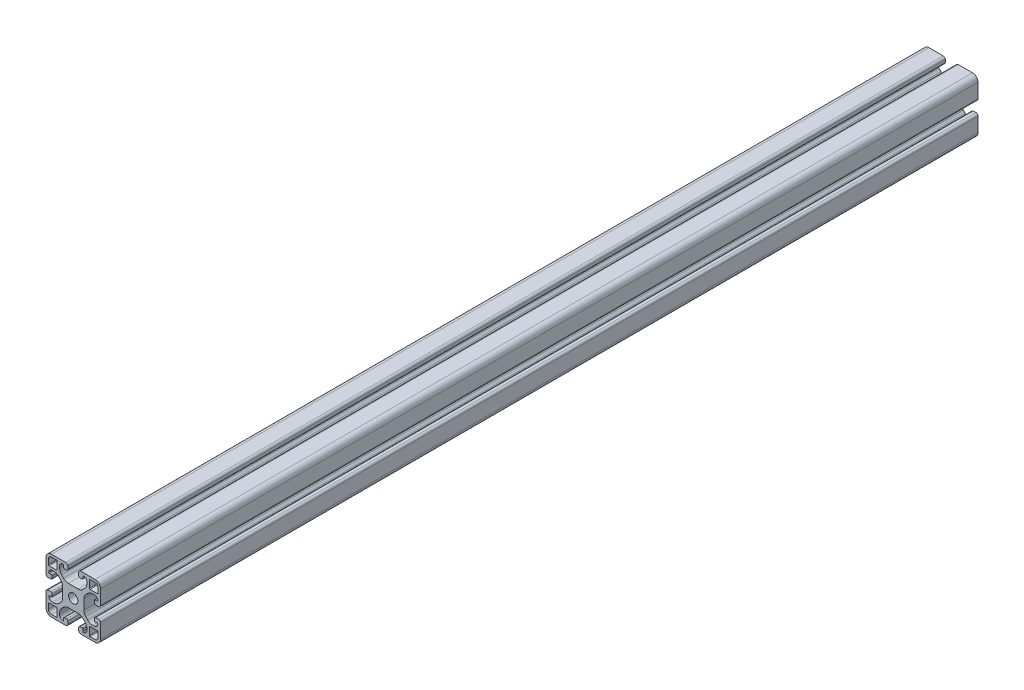
from build123d import *

# Parameters (mm, degrees)
ESQUISSE1_R        = 3.4
BOSS_EXTRU_1_DEPTH = 644


with BuildPart() as part:
    # Esquisse1 → Boss.-Extru.1 (new body)
    with BuildSketch(Plane(origin=(0, 0, -30), x_dir=(-1, 0, 0), z_dir=(0, 0, -1))):
        with BuildLine():
            Line((-4.5, 15), (-4.5, 13.5))
            ThreePointArc((-4.5, 13.5), (-4.353553391, 13.146446609), (-4, 13))
            Line((-4, 13), (-2.5, 13))
            ThreePointArc((-2.5, 13), (-2.146446609, 12.853553391), (-2, 12.5))
            ThreePointArc((-2, 12.5), (-2.732233047, 10.732233047), (-4.5, 10))
            Line((-4.5, 10), (-5.807611845, 10))
            ThreePointArc((-5.807611845, 10), (-7.721029006, 10.380602337), (-9.343145751, 11.464466094))
            Line((-9.343145751, 11.464466094), (-10.785533906, 12.906854249))
            ThreePointArc((-10.785533906, 12.906854249), (-11.869397663, 14.528970994), (-12.25, 16.442388155))
            Line((-12.25, 16.442388155), (-12.25, 23.557611845))
            ThreePointArc((-12.25, 23.557611845), (-11.869397663, 25.471029006), (-10.785533906, 27.093145751))
            Line((-10.785533906, 27.093145751), (-9.343145751, 28.535533906))
            ThreePointArc((-9.343145751, 28.535533906), (-7.721029006, 29.619397663), (-5.807611845, 30))
            Line((-5.807611845, 30), (-4.5, 30))
            ThreePointArc((-4.5, 30), (-2.732233047, 29.267766953), (-2, 27.5))
            ThreePointArc((-2, 27.5), (-2.146446609, 27.146446609), (-2.5, 27))
            Line((-2.5, 27), (-4, 27))
            ThreePointArc((-4, 27), (-4.353553391, 26.853553391), (-4.5, 26.5))
            Line((-4.5, 26.5), (-4.5, 25))
            ThreePointArc((-4.5, 25), (-4.207106781, 24.292893219), (-3.5, 24))
            Line((-3.5, 24), (-1.5, 24))
            ThreePointArc((-1.5, 24), (-0.439339828, 24.439339828), (0, 25.5))
            Line((0, 25.5), (0, 36))
            ThreePointArc((0, 36), (-1.171572875, 38.828427125), (-4, 40))
            Line((-4, 40), (-14.5, 40))
            ThreePointArc((-14.5, 40), (-15.560660172, 39.560660172), (-16, 38.5))
            Line((-16, 38.5), (-16, 36.5))
            ThreePointArc((-16, 36.5), (-15.707106781, 35.792893219), (-15, 35.5))
            Line((-15, 35.5), (-13.5, 35.5))
            ThreePointArc((-13.5, 35.5), (-13.146446609, 35.646446609), (-13, 36))
            Line((-13, 36), (-13, 37.5))
            ThreePointArc((-13, 37.5), (-12.853553391, 37.853553391), (-12.5, 38))
            ThreePointArc((-12.5, 38), (-10.732233047, 37.267766953), (-10, 35.5))
            Line((-10, 35.5), (-10, 34.192388155))
            ThreePointArc((-10, 34.192388155), (-10.380602337, 32.278970994), (-11.464466094, 30.656854249))
            Line((-11.464466094, 30.656854249), (-12.906854249, 29.214466094))
            ThreePointArc((-12.906854249, 29.214466094), (-14.528970994, 28.130602337), (-16.442388155, 27.75))
            Line((-16.442388155, 27.75), (-23.557611845, 27.75))
            ThreePointArc((-23.557611845, 27.75), (-25.471029006, 28.130602337), (-27.093145751, 29.214466094))
            Line((-27.093145751, 29.214466094), (-28.535533906, 30.656854249))
            ThreePointArc((-28.535533906, 30.656854249), (-29.619397663, 32.278970994), (-30, 34.192388155))
            Line((-30, 34.192388155), (-30, 35.5))
            ThreePointArc((-30, 35.5), (-29.267766953, 37.267766953), (-27.5, 38))
            ThreePointArc((-27.5, 38), (-27.146446609, 37.853553391), (-27, 37.5))
            Line((-27, 37.5), (-27, 36))
            ThreePointArc((-27, 36), (-26.853553391, 35.646446609), (-26.5, 35.5))
            Line((-26.5, 35.5), (-25, 35.5))
            ThreePointArc((-25, 35.5), (-24.292893219, 35.792893219), (-24, 36.5))
            Line((-24, 36.5), (-24, 38.5))
            ThreePointArc((-24, 38.5), (-24.439339828, 39.560660172), (-25.5, 40))
            Line((-25.5, 40), (-36, 40))
            ThreePointArc((-36, 40), (-38.828427125, 38.828427125), (-40, 36))
            Line((-40, 36), (-40, 25.5))
            ThreePointArc((-40, 25.5), (-39.560660172, 24.439339828), (-38.5, 24))
            Line((-38.5, 24), (-36.5, 24))
            ThreePointArc((-36.5, 24), (-35.792893219, 24.292893219), (-35.5, 25))
            Line((-35.5, 25), (-35.5, 26.5))
            ThreePointArc((-35.5, 26.5), (-35.646446609, 26.853553391), (-36, 27))
            Line((-36, 27), (-37.5, 27))
            ThreePointArc((-37.5, 27), (-37.853553391, 27.146446609), (-38, 27.5))
            ThreePointArc((-38, 27.5), (-37.267766953, 29.267766953), (-35.5, 30))
            Line((-35.5, 30), (-34.192388155, 30))
            ThreePointArc((-34.192388155, 30), (-32.278970994, 29.619397663), (-30.656854249, 28.535533906))
            Line((-30.656854249, 28.535533906), (-29.214466094, 27.093145751))
            ThreePointArc((-29.214466094, 27.093145751), (-28.130602337, 25.471029006), (-27.75, 23.557611845))
            Line((-27.75, 23.557611845), (-27.75, 16.442388155))
            ThreePointArc((-27.75, 16.442388155), (-28.130602337, 14.528970994), (-29.214466094, 12.906854249))
            Line((-29.214466094, 12.906854249), (-30.656854249, 11.464466094))
            ThreePointArc((-30.656854249, 11.464466094), (-32.278970994, 10.380602337), (-34.192388155, 10))
            Line((-34.192388155, 10), (-35.5, 10))
            ThreePointArc((-35.5, 10), (-37.267766953, 10.732233047), (-38, 12.5))
            ThreePointArc((-38, 12.5), (-37.853553391, 12.853553391), (-37.5, 13))
            Line((-37.5, 13), (-36, 13))
            ThreePointArc((-36, 13), (-35.646446609, 13.146446609), (-35.5, 13.5))
            Line((-35.5, 13.5), (-35.5, 15))
            ThreePointArc((-35.5, 15), (-35.792893219, 15.707106781), (-36.5, 16))
            Line((-36.5, 16), (-38.5, 16))
            ThreePointArc((-38.5, 16), (-39.560660172, 15.560660172), (-40, 14.5))
            Line((-40, 14.5), (-40, 4))
            ThreePointArc((-40, 4), (-38.828427125, 1.171572875), (-36, 0))
            Line((-36, 0), (-25.5, 0))
            ThreePointArc((-25.5, 0), (-24.439339828, 0.439339828), (-24, 1.5))
            Line((-24, 1.5), (-24, 3.5))
            ThreePointArc((-24, 3.5), (-24.292893219, 4.207106781), (-25, 4.5))
            Line((-25, 4.5), (-26.5, 4.5))
            ThreePointArc((-26.5, 4.5), (-26.853553391, 4.353553391), (-27, 4))
            Line((-27, 4), (-27, 2.5))
            ThreePointArc((-27, 2.5), (-27.146446609, 2.146446609), (-27.5, 2))
            ThreePointArc((-27.5, 2), (-29.267766953, 2.732233047), (-30, 4.5))
            Line((-30, 4.5), (-30, 5.807611845))
            ThreePointArc((-30, 5.807611845), (-29.619397663, 7.721029006), (-28.535533906, 9.343145751))
            Line((-28.535533906, 9.343145751), (-27.093145751, 10.785533906))
            ThreePointArc((-27.093145751, 10.785533906), (-25.471029006, 11.869397663), (-23.557611845, 12.25))
            Line((-23.557611845, 12.25), (-16.442388155, 12.25))
            ThreePointArc((-16.442388155, 12.25), (-14.528970994, 11.869397663), (-12.906854249, 10.785533906))
            Line((-12.906854249, 10.785533906), (-11.464466094, 9.343145751))
            ThreePointArc((-11.464466094, 9.343145751), (-10.380602337, 7.721029006), (-10, 5.807611845))
            Line((-10, 5.807611845), (-10, 4.5))
            ThreePointArc((-10, 4.5), (-10.732233047, 2.732233047), (-12.5, 2))
            ThreePointArc((-12.5, 2), (-12.853553391, 2.146446609), (-13, 2.5))
            Line((-13, 2.5), (-13, 4))
            ThreePointArc((-13, 4), (-13.146446609, 4.353553391), (-13.5, 4.5))
            Line((-13.5, 4.5), (-15, 4.5))
            ThreePointArc((-15, 4.5), (-15.707106781, 4.207106781), (-16, 3.5))
            Line((-16, 3.5), (-16, 1.5))
            ThreePointArc((-16, 1.5), (-15.560660172, 0.439339828), (-14.5, 0))
            Line((-14.5, 0), (-4, 0))
            ThreePointArc((-4, 0), (-1.171572875, 1.171572875), (0, 4))
            Line((0, 4), (0, 14.5))
            ThreePointArc((0, 14.5), (-0.439339828, 15.560660172), (-1.5, 16))
            Line((-1.5, 16), (-3.5, 16))
            ThreePointArc((-3.5, 16), (-4.207106781, 15.707106781), (-4.5, 15))
        make_face()
        with Locations(Location((-20, 20, 0), (0, 0, 180))):
            Circle(ESQUISSE1_R, mode=Mode.SUBTRACT)
        with BuildLine():
            Line((-4, 1.8), (-7.7, 1.8))
            ThreePointArc((-7.7, 1.8), (-8.053553391, 1.946446609), (-8.2, 2.3))
            Line((-8.2, 2.3), (-8.2, 7.7))
            ThreePointArc((-8.2, 7.7), (-8.053553391, 8.053553391), (-7.7, 8.2))
            Line((-7.7, 8.2), (-2.3, 8.2))
            ThreePointArc((-2.3, 8.2), (-1.946446609, 8.053553391), (-1.8, 7.7))
            Line((-1.8, 7.7), (-1.8, 4))
            ThreePointArc((-1.8, 4), (-2.444365081, 2.444365081), (-4, 1.8))
        make_face(mode=Mode.SUBTRACT)
        with BuildLine():
            Line((-38.2, 4), (-38.2, 7.7))
            ThreePointArc((-38.2, 7.7), (-38.053553391, 8.053553391), (-37.7, 8.2))
            Line((-37.7, 8.2), (-32.3, 8.2))
            ThreePointArc((-32.3, 8.2), (-31.946446609, 8.053553391), (-31.8, 7.7))
            Line((-31.8, 7.7), (-31.8, 2.3))
            ThreePointArc((-31.8, 2.3), (-31.946446609, 1.946446609), (-32.3, 1.8))
            Line((-32.3, 1.8), (-36, 1.8))
            ThreePointArc((-36, 1.8), (-37.555634919, 2.444365081), (-38.2, 4))
        make_face(mode=Mode.SUBTRACT)
        with BuildLine():
            Line((-36, 38.2), (-32.3, 38.2))
            ThreePointArc((-32.3, 38.2), (-31.946446609, 38.053553391), (-31.8, 37.7))
            Line((-31.8, 37.7), (-31.8, 32.3))
            ThreePointArc((-31.8, 32.3), (-31.946446609, 31.946446609), (-32.3, 31.8))
            Line((-32.3, 31.8), (-37.7, 31.8))
            ThreePointArc((-37.7, 31.8), (-38.053553391, 31.946446609), (-38.2, 32.3))
            Line((-38.2, 32.3), (-38.2, 36))
            ThreePointArc((-38.2, 36), (-37.555634919, 37.555634919), (-36, 38.2))
        make_face(mode=Mode.SUBTRACT)
        with BuildLine():
            Line((-1.8, 36), (-1.8, 32.3))
            ThreePointArc((-1.8, 32.3), (-1.946446609, 31.946446609), (-2.3, 31.8))
            Line((-2.3, 31.8), (-7.7, 31.8))
            ThreePointArc((-7.7, 31.8), (-8.053553391, 31.946446609), (-8.2, 32.3))
            Line((-8.2, 32.3), (-8.2, 37.7))
            ThreePointArc((-8.2, 37.7), (-8.053553391, 38.053553391), (-7.7, 38.2))
            Line((-7.7, 38.2), (-4, 38.2))
            ThreePointArc((-4, 38.2), (-2.444365081, 37.555634919), (-1.8, 36))
        make_face(mode=Mode.SUBTRACT)
    extrude(amount=-BOSS_EXTRU_1_DEPTH)


solid = part.part
